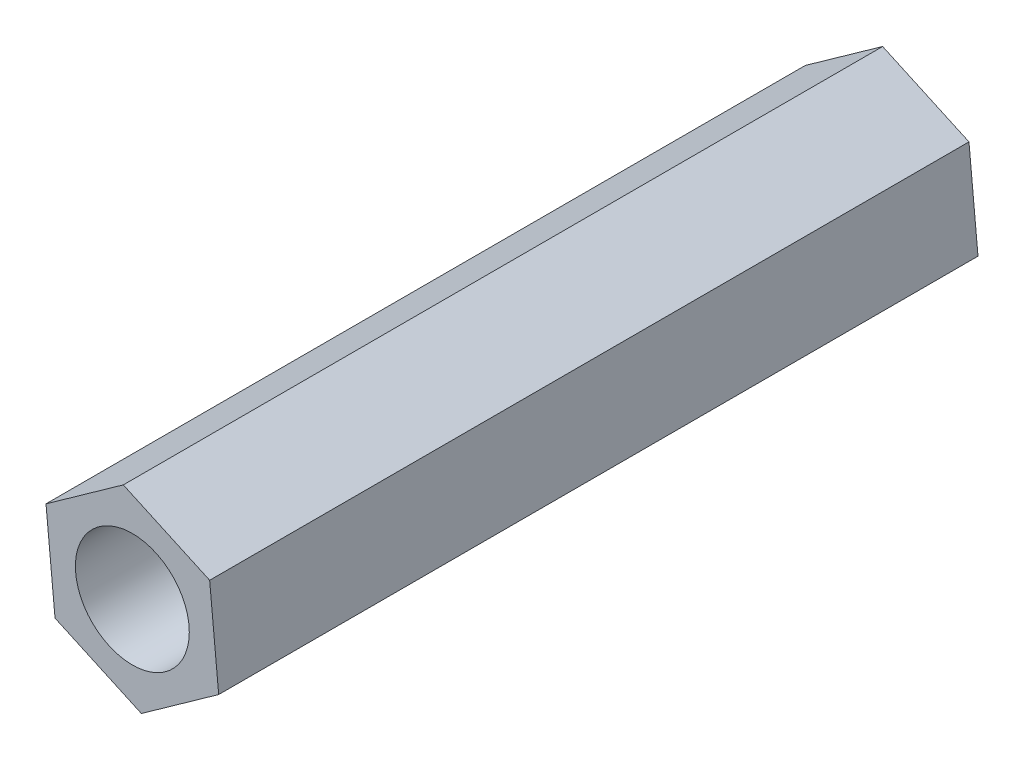
from build123d import *

# Parameters (mm, degrees)
SKETCH1_R           = 1.5
BOSS_EXTRUDE1_DEPTH = 20


with BuildPart() as part:
    # Sketch1 → Boss-Extrude1 (new body)
    with BuildSketch(Plane.XY):
        Polygon((2.036416368, 1.450175292), (-0.237680459, 2.488675953), (-2.274096827, 1.038500661), (-2.036416368, -1.450175292), (0.237680459, -2.488675953), (2.274096827, -1.038500661), align=None)
        Circle(SKETCH1_R, mode=Mode.SUBTRACT)
    extrude(amount=BOSS_EXTRUDE1_DEPTH)


solid = part.part
